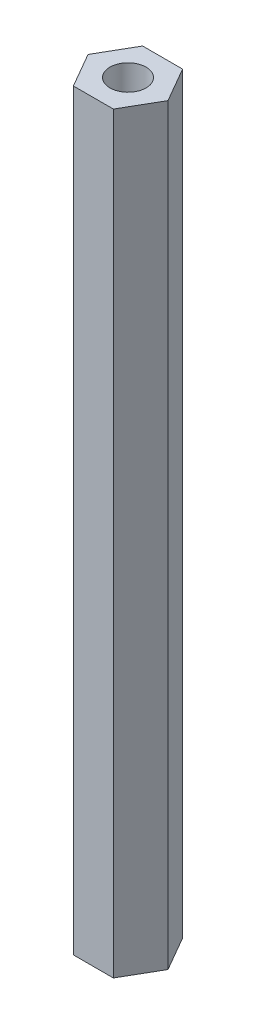
from build123d import *

# Parameters (mm, degrees)
SKETCH1_R           = 1.2
BOSS_EXTRUDE1_DEPTH = 50


with BuildPart() as part:
    # Sketch1 → Boss-Extrude1 (new body)
    with BuildSketch(Plane(origin=(0, 0, 0), x_dir=(1, 0, 0), z_dir=(0, 1, 0))):
        Polygon((2.655811238, 0), (1.327905619, 2.3), (-1.327905619, 2.3), (-2.655811238, 0), (-1.327905619, -2.3), (1.327905619, -2.3), align=None)
        with Locations(Location((0, 0, 0), (0, 0, 270))):
            Circle(SKETCH1_R, mode=Mode.SUBTRACT)
    extrude(amount=BOSS_EXTRUDE1_DEPTH)


solid = part.part
